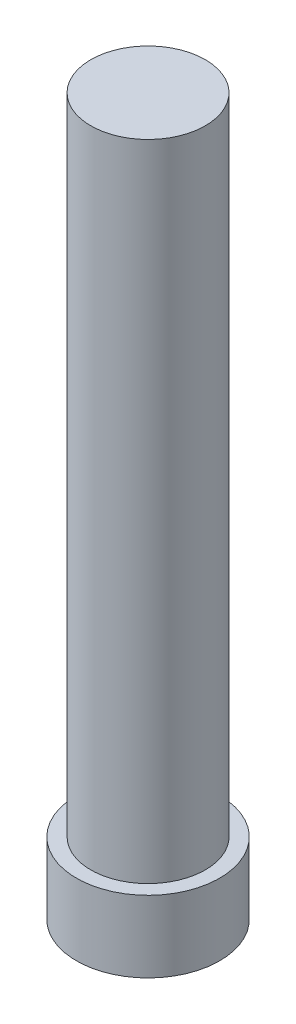
from build123d import *

# Parameters (mm, degrees)
SKETCH_1_R      = 4
EXTRUDE_1_DEPTH = 45
SKETCH_2_R      = 5
EXTRUDE_2_DEPTH = 5


with BuildPart() as part:
    # 草图1 → 凸台-拉伸1 (new body)
    with BuildSketch(Plane(origin=(0, 0, 0), x_dir=(1, 0, 0), z_dir=(0, 1, 0))):
        with Locations(Location((0, 0, 0), (0, 0, 90))):
            Circle(SKETCH_1_R)
    extrude(amount=EXTRUDE_1_DEPTH)

    # 草图2 → 凸台-拉伸2 (add)
    with BuildSketch(Plane.XZ):
        with Locations(Location((0, 0, 0), (0, 0, 270))):
            Circle(SKETCH_2_R)
    extrude(amount=EXTRUDE_2_DEPTH)


solid = part.part
